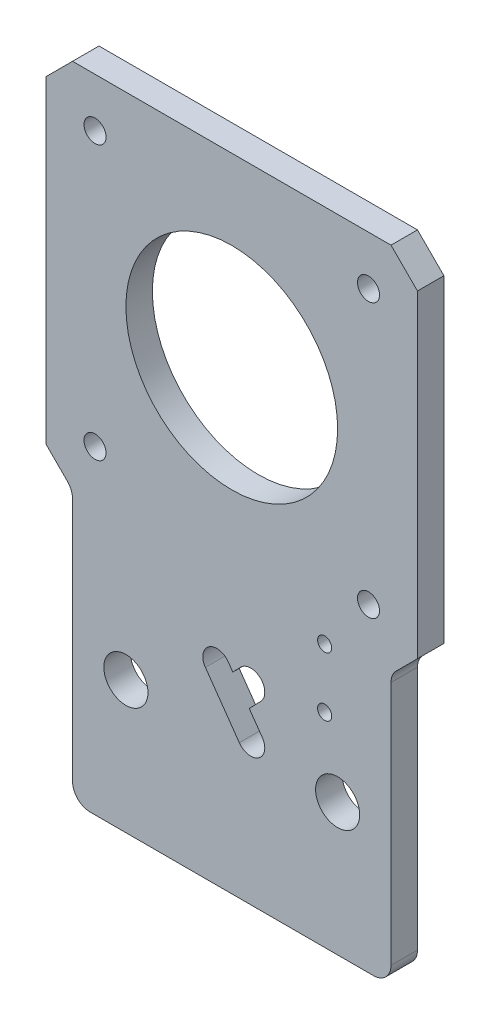
from build123d import *

# Parameters (mm, degrees)
SKETCH1_R                   = 12
BOSS_EXTRUDE1_DEPTH         = 3
TAP_DRILL_FOR_M3_TAP1_D     = 2.5
TAP_DRILL_FOR_M3_TAP1_DEPTH = 5
TAP_DRILL_FOR_M3_TAP1_TIP   = 0.751075774
TAP_DRILL_FOR_M6_TAP1_D     = 5
TAP_DRILL_FOR_M6_TAP1_DEPTH = 5
TAP_DRILL_FOR_M6_TAP1_TIP   = 1.502151548
FILLET1_R                   = 2
TAP_DRILL_FOR_M2_TAP1_D     = 1.6
TAP_DRILL_FOR_M2_TAP1_DEPTH = 5
TAP_DRILL_FOR_M2_TAP1_TIP   = 0.480688495
CUT_EXTRUDE1_DEPTH          = 10


with BuildPart() as part:
    # Sketch1 → Boss-Extrude1 (new body)
    with BuildSketch(Plane.XY):
        Polygon((18.05, -51.655), (18.05, -21.05), (21.05, -18.05), (21.05, 18.05), (18.05, 21.05), (-18.05, 21.05), (-21.05, 18.05), (-21.05, -18.05), (-18.05, -21.05), (-18.05, -51.655), align=None)
        Circle(SKETCH1_R, mode=Mode.SUBTRACT)
    extrude(amount=BOSS_EXTRUDE1_DEPTH)

    # Tap Drill for M3 Tap1
    with Locations(Plane.XY.offset(3)):
        with Locations((-15.5, 15.5), (15.5, 15.5), (-15.5, -15.5), (15.5, -15.5)):
            Hole(TAP_DRILL_FOR_M3_TAP1_D / 2, depth=TAP_DRILL_FOR_M3_TAP1_DEPTH)
            with Locations((0, 0, -(TAP_DRILL_FOR_M3_TAP1_DEPTH + TAP_DRILL_FOR_M3_TAP1_TIP / 2))):  # 118° drill point
                Cone(0, TAP_DRILL_FOR_M3_TAP1_D / 2, TAP_DRILL_FOR_M3_TAP1_TIP, mode=Mode.SUBTRACT)

    # Tap Drill for M6 Tap1
    with Locations(Plane.XY.offset(3)):
        with Locations((-12, -36.655), (12, -36.655)):
            Hole(TAP_DRILL_FOR_M6_TAP1_D / 2, depth=TAP_DRILL_FOR_M6_TAP1_DEPTH)
            with Locations((0, 0, -(TAP_DRILL_FOR_M6_TAP1_DEPTH + TAP_DRILL_FOR_M6_TAP1_TIP / 2))):  # 118° drill point
                Cone(0, TAP_DRILL_FOR_M6_TAP1_D / 2, TAP_DRILL_FOR_M6_TAP1_TIP, mode=Mode.SUBTRACT)

    # Fillet1
    fillet1_edges = [part.edges().sort_by_distance(p)[0] for p in [
        (18.05, -21.05, 1.5),
        (18.05, -51.655, 1.5),
        (-18.05, -51.655, 1.5),
        (-18.05, -21.05, 1.5),
    ]]
    fillet(fillet1_edges, radius=FILLET1_R)

    # Tap Drill for M2 Tap1
    with Locations(Plane.XY.offset(3)):
        with Locations((10.52945603, -21.86131015), (10.52945603, -28.56131015)):
            Hole(TAP_DRILL_FOR_M2_TAP1_D / 2, depth=TAP_DRILL_FOR_M2_TAP1_DEPTH)
            with Locations((0, 0, -(TAP_DRILL_FOR_M2_TAP1_DEPTH + TAP_DRILL_FOR_M2_TAP1_TIP / 2))):  # 118° drill point
                Cone(0, TAP_DRILL_FOR_M2_TAP1_D / 2, TAP_DRILL_FOR_M2_TAP1_TIP, mode=Mode.SUBTRACT)

    # Sketch8 → Cut-Extrude1 (cut)
    with BuildSketch(Plane(origin=(0, 0, 0), x_dir=(-1, 0, 0), z_dir=(0, 0, -1))):
        with BuildLine():
            Line((-0.855282685, -36.386266358), (2.992061815, -30.914487513))
            ThreePointArc((2.992061815, -30.914487513), (2.60653362, -28.702773131), (0.394819237, -29.088301326))
            Line((0.394819237, -29.088301326), (-0.119454204, -29.819712442))
            Line((-0.119454204, -29.819712442), (-1.013815468, -28.896697877))
            ThreePointArc((-1.013815468, -28.896697877), (-3.258600516, -28.861305914), (-3.293992479, -31.106090962))
            Line((-3.293992479, -31.106090962), (-1.978516355, -32.463711947))
            Line((-1.978516355, -32.463711947), (-3.452525263, -34.56008017))
            ThreePointArc((-3.452525263, -34.56008017), (-3.066997067, -36.771794553), (-0.855282685, -36.386266358))
        make_face()
    extrude(amount=-CUT_EXTRUDE1_DEPTH, mode=Mode.SUBTRACT)


solid = part.part
